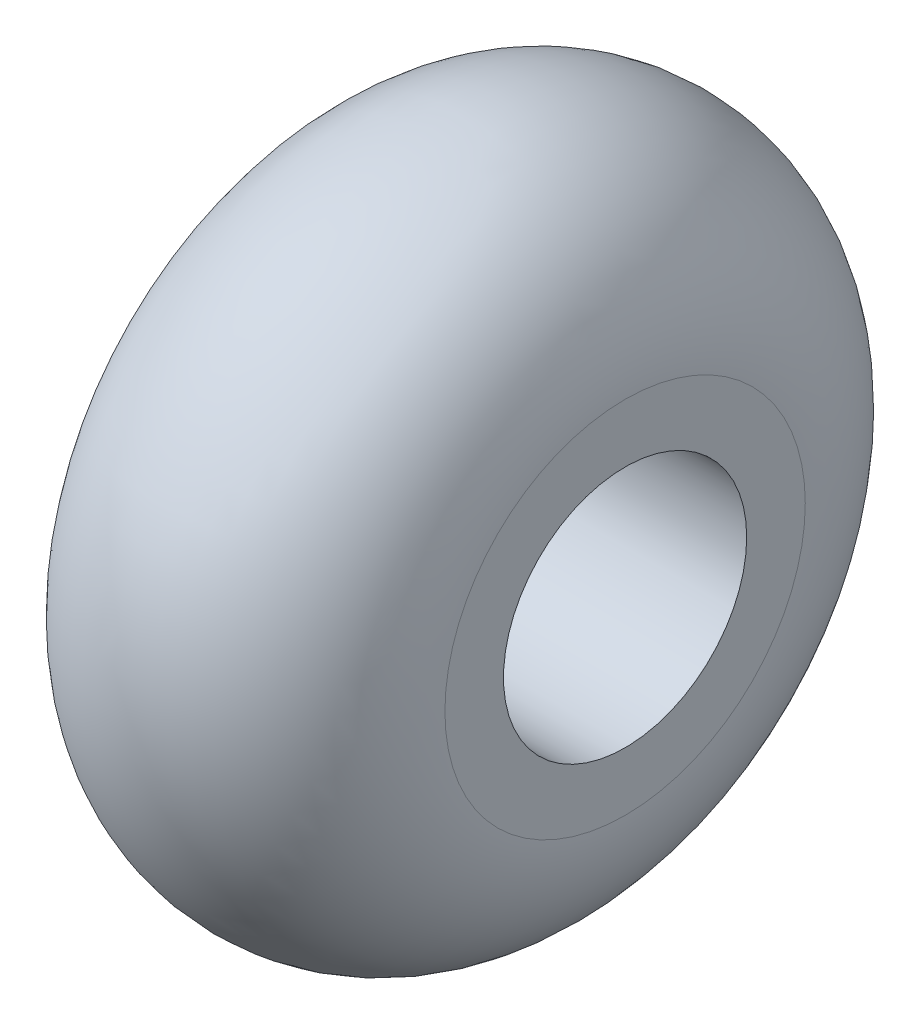
from build123d import *


with BuildPart() as part:
    # Sketch1 → Revolve1 (revolve)
    with BuildSketch(Plane.XY, mode=Mode.PRIVATE) as revolve1_sk:
        with BuildLine():
            Line((11, 4.05), (0, 4.05))
            Line((0, 4.05), (0, 6))
            ThreePointArc((0, 6), (5.5, 11.5), (11, 6))
            Line((11, 6), (11, 4.05))
        make_face()
    revolve(revolve1_sk.sketch.rotate(Axis((13.609311741, 0, 0), (-1, 0, 0)), 90), axis=Axis((13.609311741, 0, 0), (-1, 0, 0)))


solid = part.part
